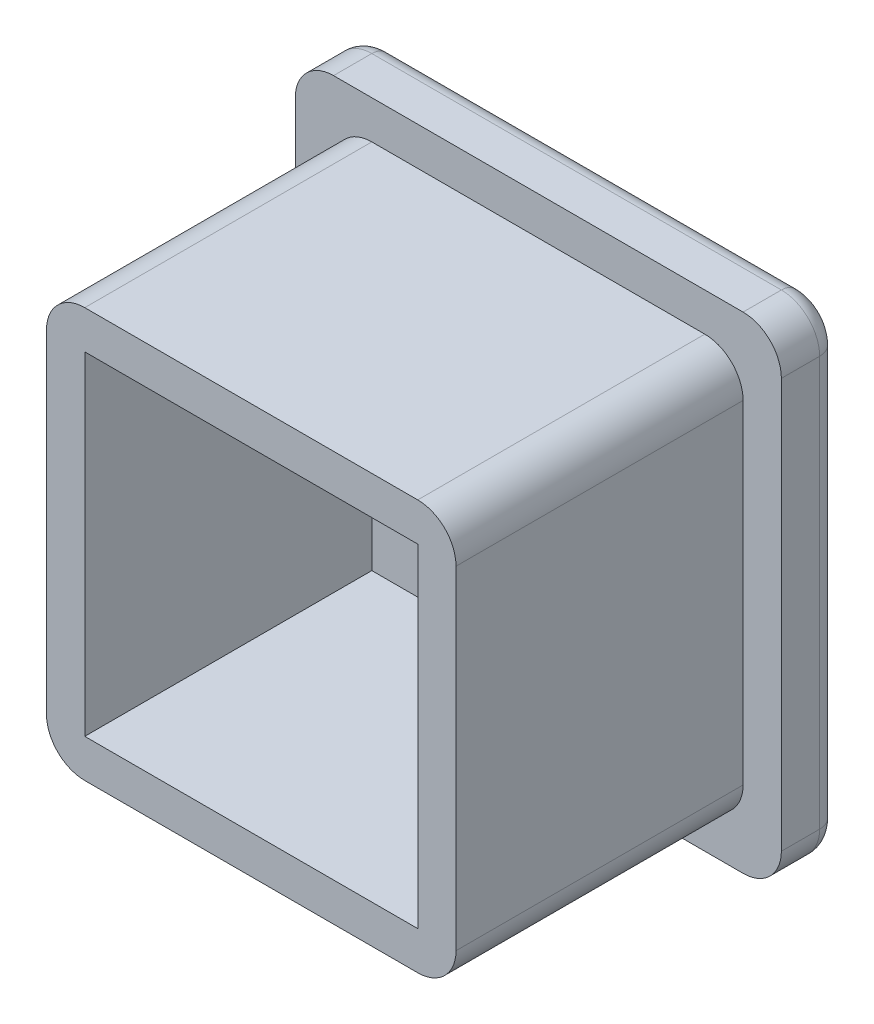
from build123d import *

# Parameters (mm, degrees)
CROQUIS1_W              = 25.4
CROQUIS1_H              = 25.4
SALIENTE_EXTRUIR1_DEPTH = 18
CROQUIS2_W              = 25.4
CROQUIS2_H              = 25.4
CROQUIS2_W_2            = 21.4
CROQUIS2_H_2            = 21.4
CROQUIS2_W_3            = 17.4
CROQUIS2_H_3            = 17.4
CORTAR_EXTRUIR1_DEPTH   = 15
REDONDEO3_R             = 2
REDONDEO4_R             = 1
CROQUIS16_W             = 8
CROQUIS16_H             = 1.5
CORTAR_EXTRUIR13_DEPTH  = 2


with BuildPart() as part:
    # Croquis1 → Saliente-Extruir1 (new body)
    with BuildSketch(Plane.XY):
        Rectangle(CROQUIS1_W, CROQUIS1_H)
    extrude(amount=SALIENTE_EXTRUIR1_DEPTH)

    # Croquis2 → Cortar-Extruir1 (cut)
    # profile 1 of 2: a face of its own
    with BuildSketch(Plane.XY.offset(18)):
        Rectangle(CROQUIS2_W, CROQUIS2_H)
        Rectangle(CROQUIS2_W_2, CROQUIS2_H_2, mode=Mode.SUBTRACT)
    # profile 2 of 2: a face of its own
    with BuildSketch(Plane.XY.offset(18)):
        Rectangle(CROQUIS2_W_3, CROQUIS2_H_3)
    extrude(amount=-CORTAR_EXTRUIR1_DEPTH, mode=Mode.SUBTRACT)

    # Redondeo3
    redondeo3_edges = [part.edges().sort_by_distance(p)[0] for p in [
        (-12.7, 12.7, 1.5),
        (12.7, 12.7, 1.5),
        (12.7, -12.7, 1.5),
        (-12.7, -12.7, 1.5),
        (10.7, 10.7, 10.5),
        (-10.7, 10.7, 10.5),
        (-10.7, -10.7, 10.5),
        (10.7, -10.7, 10.5),
    ]]
    fillet(redondeo3_edges, radius=REDONDEO3_R)

    # Redondeo4
    redondeo4_edges = [part.edges().sort_by_distance(p)[0] for p in [
        (0, 12.7, 0),
        (-12.7, 0, 0),
        (12.7, 0, 0),
        (0, -12.7, 0),
        (12.114213562, -12.114213562, 0),
        (-12.114213562, -12.114213562, 0),
        (-12.114213562, 12.114213562, 0),
        (12.114213562, 12.114213562, 0),
    ]]
    fillet(redondeo4_edges, radius=REDONDEO4_R)

    # Croquis16 → Cortar-Extruir13 (cut)
    with BuildSketch(Plane.XZ.offset(12.7)):
        with Locations((0, 2.25)):
            Rectangle(CROQUIS16_W, CROQUIS16_H)
    extrude(amount=-CORTAR_EXTRUIR13_DEPTH, mode=Mode.SUBTRACT)


solid = part.part
